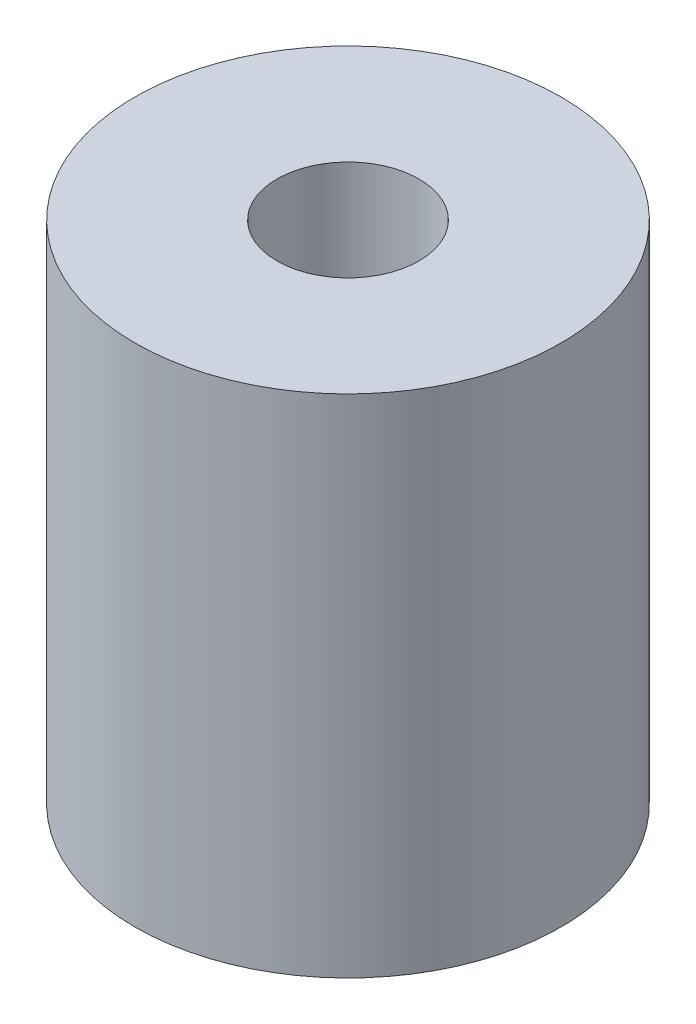
from build123d import *

# Parameters (mm, degrees)
SKETCH1_R           = 9.525
SKETCH1_R_2         = 3.175
BOSS_EXTRUDE1_DEPTH = 22.61


with BuildPart() as part:
    # Sketch1 → Boss-Extrude1 (new body)
    with BuildSketch(Plane(origin=(0, 0, 0), x_dir=(1, 0, 0), z_dir=(0, 1, 0))):
        with Locations(Location((0, 0, 0), (0, 0, 270))):
            Circle(SKETCH1_R)
        with Locations(Location((0, 0, 0), (0, 0, 270))):
            Circle(SKETCH1_R_2, mode=Mode.SUBTRACT)
    extrude(amount=BOSS_EXTRUDE1_DEPTH)


solid = part.part
